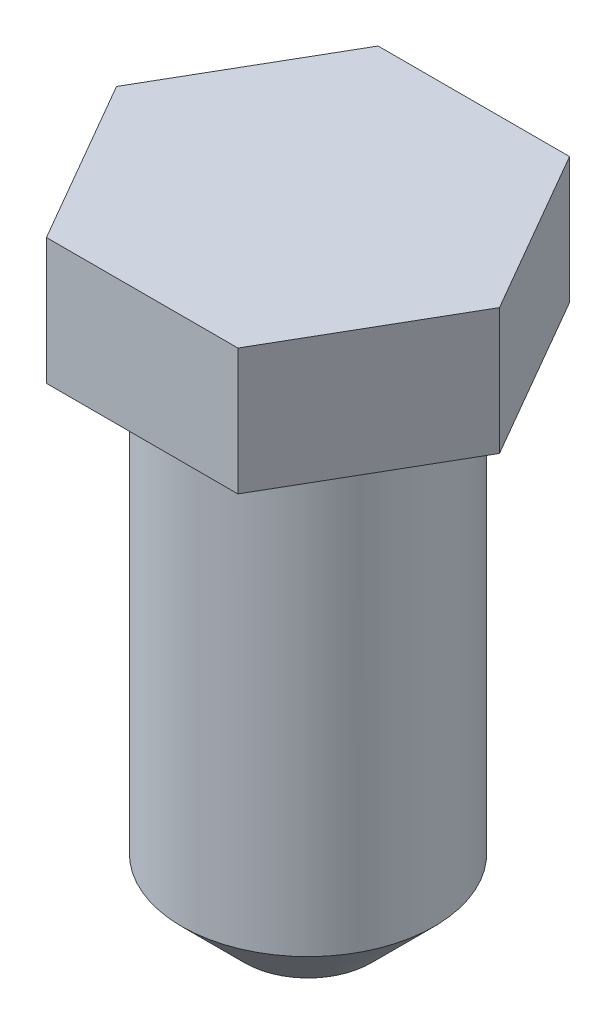
from build123d import *

# Parameters (mm, degrees)
BOSS_EXTRUDE1_DEPTH = 12.7
SKETCH2_R           = 12.7
BOSS_EXTRUDE2_DEPTH = 44.45
SKETCH3_R           = 12.7
BOSS_EXTRUDE3_DEPTH = 6.35
CHAMFER1_SIZE       = 6.35


with BuildPart() as part:
    # Sketch1 → Boss-Extrude1 (new body)
    with BuildSketch(Plane(origin=(0, 0, 0), x_dir=(1, 0, 0), z_dir=(0, 1, 0))):
        Polygon((19.247414599, 0), (9.6237073, 16.66875), (-9.6237073, 16.66875), (-19.247414599, 0), (-9.6237073, -16.66875), (9.6237073, -16.66875), align=None)
    extrude(amount=BOSS_EXTRUDE1_DEPTH)

    # Sketch2 → Boss-Extrude2 (add)
    with BuildSketch(Plane.XZ):
        with Locations(Location((0, 0, 0), (0, 0, 270))):
            Circle(SKETCH2_R)
    extrude(amount=BOSS_EXTRUDE2_DEPTH)

    # Sketch3 → Boss-Extrude3 (add)
    with BuildSketch(Plane(origin=(0, -44.45, 0), x_dir=(-1, 0, 0), z_dir=(0, -1, 0))):
        with Locations(Location((0, 0, 0), (0, 0, 90))):
            Circle(SKETCH3_R)
    extrude(amount=BOSS_EXTRUDE3_DEPTH)

    # Chamfer1
    chamfer1_edges = [part.edges().sort_by_distance(p)[0] for p in [
        (0, -50.8, 12.7),
    ]]
    chamfer(chamfer1_edges, length=CHAMFER1_SIZE)


solid = part.part
